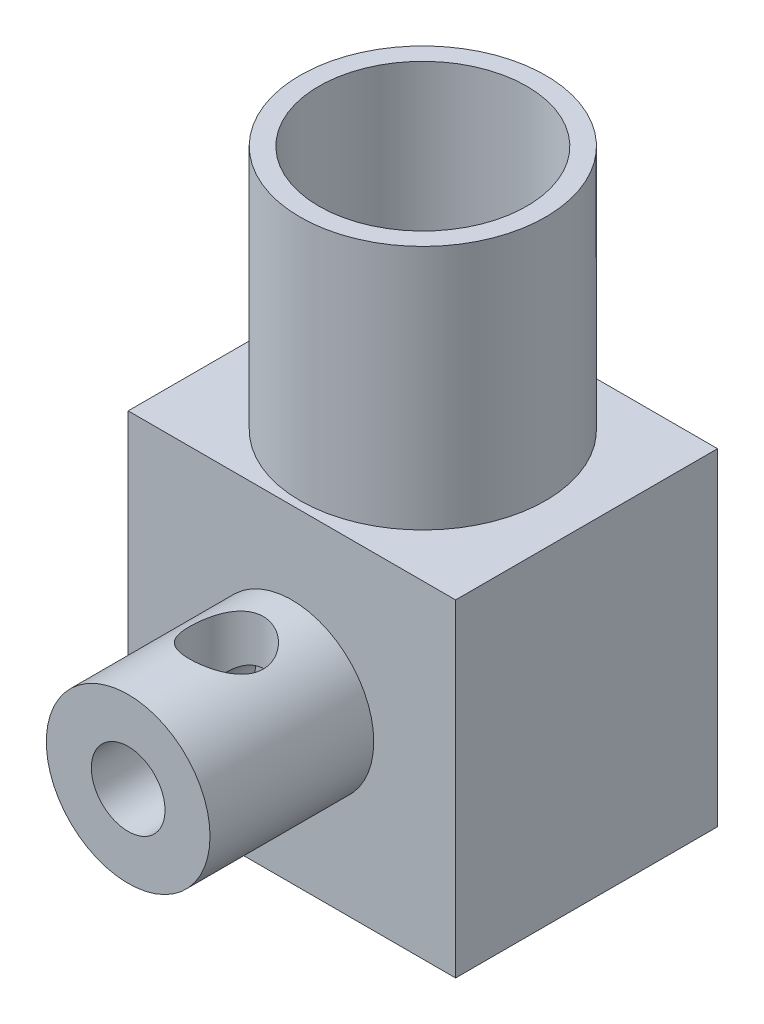
from build123d import *

# Parameters (mm, degrees)
CROQUIS1_W              = 20
CROQUIS1_H              = 20
SALIENTE_EXTRUIR1_DEPTH = 16
CROQUIS2_R              = 5
CROQUIS2_R_2            = 2.25
SALIENTE_EXTRUIR2_DEPTH = 10
CROQUIS6_R              = 7.5
CROQUIS6_R_2            = 6.35
SALIENTE_EXTRUIR3_DEPTH = 15
CROQUIS7_R              = 2.25
CORTAR_EXTRUIR1_DEPTH   = 10


with BuildPart() as part:
    # Croquis1 → Saliente-Extruir1 (new body)
    with BuildSketch(Plane.XY):
        Rectangle(CROQUIS1_W, CROQUIS1_H)
    extrude(amount=SALIENTE_EXTRUIR1_DEPTH)

    # Croquis2 → Saliente-Extruir2 (add)
    with BuildSketch(Plane.XY.offset(16)):
        Circle(CROQUIS2_R)
        Circle(CROQUIS2_R_2, mode=Mode.SUBTRACT)
    extrude(amount=SALIENTE_EXTRUIR2_DEPTH)

    # Croquis6 → Saliente-Extruir3 (add)
    with BuildSketch(Plane(origin=(0, 10, 0), x_dir=(1, 0, 0), z_dir=(0, 1, 0))):
        with Locations(Location((0, -8, 0), (0, 0, 270))):
            Circle(CROQUIS6_R)
        with Locations(Location((0, -8, 0), (0, 0, 270))):
            Circle(CROQUIS6_R_2, mode=Mode.SUBTRACT)
    extrude(amount=SALIENTE_EXTRUIR3_DEPTH)

    # Croquis7 → Cortar-Extruir1 (cut)
    with BuildSketch(Plane(origin=(0, 10, 0), x_dir=(1, 0, 0), z_dir=(0, 1, 0))):
        with Locations(Location((0, -20, 0), (0, 0, 270))):
            Circle(CROQUIS7_R)
    extrude(amount=-CORTAR_EXTRUIR1_DEPTH, mode=Mode.SUBTRACT)


solid = part.part
